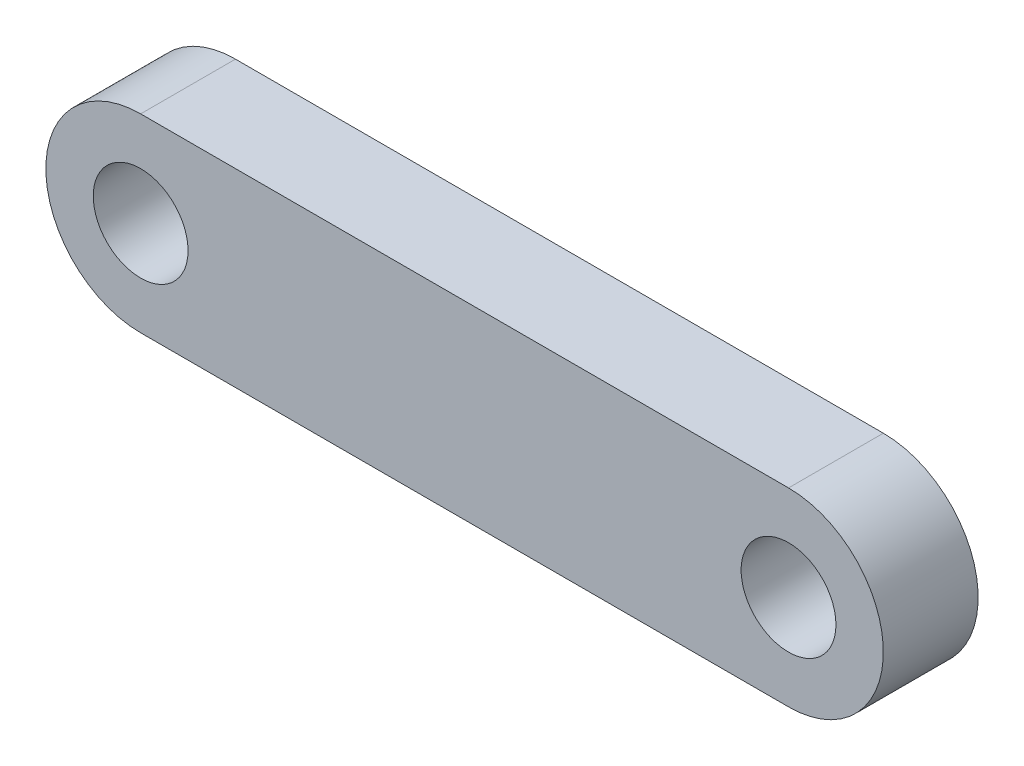
from build123d import *

# Parameters (mm, degrees)
SKETCH_1_R      = 1.5
EXTRUDE_1_DEPTH = 3


with BuildPart() as part:
    # 草图1 → 凸台-拉伸1 (new body)
    with BuildSketch(Plane.XY):
        with BuildLine():
            Line((0, 3), (20.5, 3))
            ThreePointArc((20.5, 3), (23.5, 0), (20.5, -3))
            Line((20.5, -3), (0, -3))
            ThreePointArc((0, -3), (-3, 0), (0, 3))
        make_face()
        Circle(SKETCH_1_R, mode=Mode.SUBTRACT)
        with Locations((20.5, 0)):
            Circle(SKETCH_1_R, mode=Mode.SUBTRACT)
    extrude(amount=EXTRUDE_1_DEPTH)


solid = part.part
